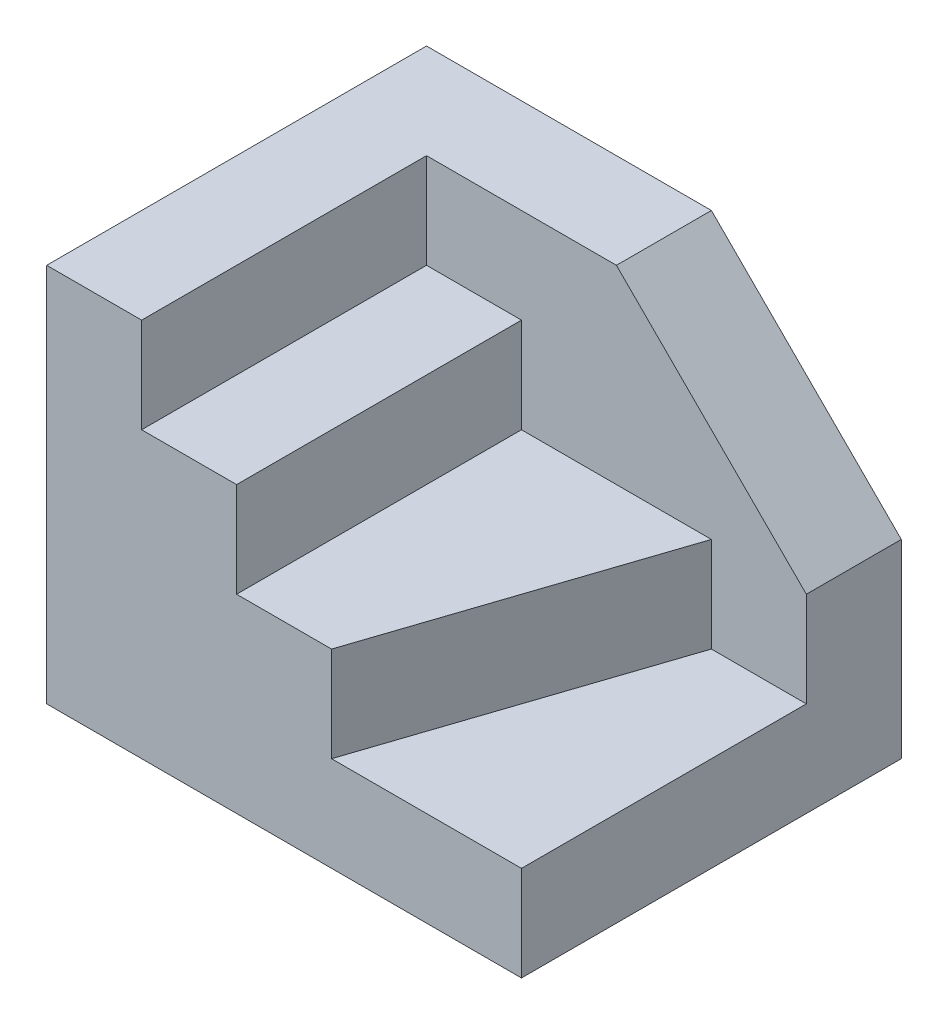
from build123d import *

# Parameters (mm, degrees)
BOSS_EXTRUDE1_DEPTH = 40
SKETCH1_7_W         = 10
SKETCH1_7_H         = 30
BOSS_EXTRUDE2_DEPTH = 30
BOSS_EXTRUDE3_DEPTH = 20
BOSS_EXTRUDE4_DEPTH = 10
CHAMFER1_SIZE       = 20


with BuildPart() as part:
    # Sketch1 → Boss-Extrude1 (new body)
    with BuildSketch(Plane(origin=(0, 0, 0), x_dir=(1, 0, 0), z_dir=(0, 1, 0))):
        Polygon((0, 0), (10, 0), (10, 30), (20, 30), (40, 30), (50, 30), (50, 40), (0, 40), align=None)
    extrude(amount=BOSS_EXTRUDE1_DEPTH)

    # Sketch1<7> → Boss-Extrude2 (add)
    with BuildSketch(Plane(origin=(0, 0, 0), x_dir=(1, 0, 0), z_dir=(0, 1, 0))):
        with Locations((15, 15)):
            Rectangle(SKETCH1_7_W, SKETCH1_7_H)
    extrude(amount=BOSS_EXTRUDE2_DEPTH)

    # Sketch1<8> → Boss-Extrude3 (add)
    with BuildSketch(Plane(origin=(0, 0, 0), x_dir=(1, 0, 0), z_dir=(0, 1, 0))):
        Polygon((20, 30), (20, 0), (30, 0), (40, 30), align=None)
    extrude(amount=BOSS_EXTRUDE3_DEPTH)

    # Sketch1<9> → Boss-Extrude4 (add)
    with BuildSketch(Plane(origin=(0, 0, 0), x_dir=(1, 0, 0), z_dir=(0, 1, 0))):
        Polygon((40, 30), (30, 0), (50, 0), (50, 30), align=None)
    extrude(amount=BOSS_EXTRUDE4_DEPTH)

    # Chamfer1
    chamfer1_edges = [part.edges().sort_by_distance(p)[0] for p in [
        (50, 40, -35),
    ]]
    chamfer(chamfer1_edges, length=CHAMFER1_SIZE)


solid = part.part
